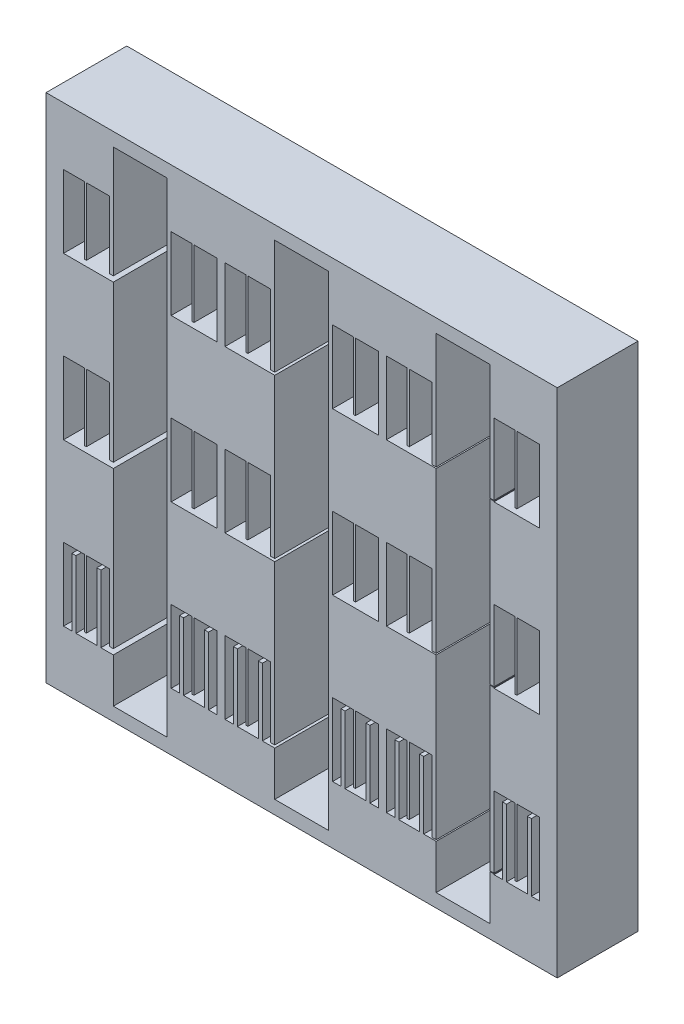
from build123d import *

# Parameters (mm, degrees)
SKETCH1_W           = 190
SKETCH1_H           = 190
BOSS_EXTRUDE1_DEPTH = 30
SKETCH2_W           = 20
SKETCH2_H           = 180
CUT_EXTRUDE1_DEPTH  = 138.658998979
SKETCH3_W           = 17
SKETCH3_H           = 27
CUT_EXTRUDE2_DEPTH  = 28.5
SKETCH4_W           = 1.5
SKETCH4_H           = 25
SKETCH4_W_2         = 0.75
BOSS_EXTRUDE2_DEPTH = 28.5
SKETCH5_W           = 1.5
SKETCH5_H           = 2
SKETCH5_H_2         = 1
SKETCH5_H_3         = 0.5
SKETCH5_H_4         = 0.25
CUT_EXTRUDE3_DEPTH  = 28.5


with BuildPart() as part:
    # Sketch1 → Boss-Extrude1 (new body)
    with BuildSketch(Plane.XY):
        Rectangle(SKETCH1_W, SKETCH1_H)
    extrude(amount=-BOSS_EXTRUDE1_DEPTH)

    # Sketch2 → Cut-Extrude1 (cut, through all)
    with BuildSketch(Plane.XY):
        with Locations((-60, 0)):
            Rectangle(SKETCH2_W, SKETCH2_H)
        Rectangle(SKETCH2_W, SKETCH2_H)
        with Locations((60, 0)):
            Rectangle(SKETCH2_W, SKETCH2_H)
    extrude(amount=-CUT_EXTRUDE1_DEPTH, mode=Mode.SUBTRACT)

    # Sketch3 → Cut-Extrude2 (cut)
    with BuildSketch(Plane.XY):
        with Locations((-80, -60)):
            Rectangle(SKETCH3_W, SKETCH3_H)
        with Locations((-40, -60)):
            Rectangle(SKETCH3_W, SKETCH3_H)
        with Locations((-20, -60)):
            Rectangle(SKETCH3_W, SKETCH3_H)
        with Locations((20, -60)):
            Rectangle(SKETCH3_W, SKETCH3_H)
        with Locations((40, -60)):
            Rectangle(SKETCH3_W, SKETCH3_H)
        with Locations((80, -60)):
            Rectangle(SKETCH3_W, SKETCH3_H)
        with Locations((-80, 0)):
            Rectangle(SKETCH3_W, SKETCH3_H)
        with Locations((-40, 0)):
            Rectangle(SKETCH3_W, SKETCH3_H)
        with Locations((-20, 0)):
            Rectangle(SKETCH3_W, SKETCH3_H)
        with Locations((20, 0)):
            Rectangle(SKETCH3_W, SKETCH3_H)
        with Locations((40, 0)):
            Rectangle(SKETCH3_W, SKETCH3_H)
        with Locations((80, 0)):
            Rectangle(SKETCH3_W, SKETCH3_H)
        with Locations((-80, 60)):
            Rectangle(SKETCH3_W, SKETCH3_H)
        with Locations((-40, 60)):
            Rectangle(SKETCH3_W, SKETCH3_H)
        with Locations((-20, 60)):
            Rectangle(SKETCH3_W, SKETCH3_H)
        with Locations((20, 60)):
            Rectangle(SKETCH3_W, SKETCH3_H)
        with Locations((40, 60)):
            Rectangle(SKETCH3_W, SKETCH3_H)
        with Locations((80, 60)):
            Rectangle(SKETCH3_W, SKETCH3_H)
    extrude(amount=-CUT_EXTRUDE2_DEPTH, mode=Mode.SUBTRACT)

    # Sketch4 → Boss-Extrude2 (add)
    with BuildSketch(Plane.XY):
        with Locations((-75.375, -61)):
            Rectangle(SKETCH4_W, SKETCH4_H)
        with Locations((-80.375, -59)):
            Rectangle(SKETCH4_W_2, SKETCH4_H)
        with Locations((-84.625, -61)):
            Rectangle(SKETCH4_W, SKETCH4_H)
        with Locations((-44.625, -61)):
            Rectangle(SKETCH4_W, SKETCH4_H)
        with Locations((-40.375, -59)):
            Rectangle(SKETCH4_W_2, SKETCH4_H)
        with Locations((-35.375, -61)):
            Rectangle(SKETCH4_W, SKETCH4_H)
        with Locations((-15.375, -61)):
            Rectangle(SKETCH4_W, SKETCH4_H)
        with Locations((-20.375, -59)):
            Rectangle(SKETCH4_W_2, SKETCH4_H)
        with Locations((-24.625, -61)):
            Rectangle(SKETCH4_W, SKETCH4_H)
        with Locations((15.375, -61)):
            Rectangle(SKETCH4_W, SKETCH4_H)
        with Locations((19.625, -59)):
            Rectangle(SKETCH4_W_2, SKETCH4_H)
        with Locations((24.625, -61)):
            Rectangle(SKETCH4_W, SKETCH4_H)
        with Locations((44.625, -61)):
            Rectangle(SKETCH4_W, SKETCH4_H)
        with Locations((39.625, -59)):
            Rectangle(SKETCH4_W_2, SKETCH4_H)
        with Locations((35.375, -61)):
            Rectangle(SKETCH4_W, SKETCH4_H)
        with Locations((75.375, -61)):
            Rectangle(SKETCH4_W, SKETCH4_H)
        with Locations((79.625, -59)):
            Rectangle(SKETCH4_W_2, SKETCH4_H)
        with Locations((84.625, -61)):
            Rectangle(SKETCH4_W, SKETCH4_H)
        with Locations((-80.375, 1)):
            Rectangle(SKETCH4_W_2, SKETCH4_H)
        with Locations((-40.375, 1)):
            Rectangle(SKETCH4_W_2, SKETCH4_H)
        with Locations((-20.375, 1)):
            Rectangle(SKETCH4_W_2, SKETCH4_H)
        with Locations((19.625, 1)):
            Rectangle(SKETCH4_W_2, SKETCH4_H)
        with Locations((39.625, 1)):
            Rectangle(SKETCH4_W_2, SKETCH4_H)
        with Locations((79.625, 1)):
            Rectangle(SKETCH4_W_2, SKETCH4_H)
        with Locations((-80.375, 61)):
            Rectangle(SKETCH4_W_2, SKETCH4_H)
        with Locations((-40.375, 61)):
            Rectangle(SKETCH4_W_2, SKETCH4_H)
        with Locations((-20.375, 61)):
            Rectangle(SKETCH4_W_2, SKETCH4_H)
        with Locations((19.625, 61)):
            Rectangle(SKETCH4_W_2, SKETCH4_H)
        with Locations((39.625, 61)):
            Rectangle(SKETCH4_W_2, SKETCH4_H)
        with Locations((79.625, 61)):
            Rectangle(SKETCH4_W_2, SKETCH4_H)
    extrude(amount=-BOSS_EXTRUDE2_DEPTH)

    # Sketch5 → Cut-Extrude3 (cut)
    with BuildSketch(Plane.XY):
        with Locations((-70.75, -72.5)):
            Rectangle(SKETCH5_W, SKETCH5_H)
        with Locations((-10.75, -73)):
            Rectangle(SKETCH5_W, SKETCH5_H_2)
        with Locations((49.25, -73.25)):
            Rectangle(SKETCH5_W, SKETCH5_H_3)
        with Locations((70.75, -73.125)):
            Rectangle(SKETCH5_W, SKETCH5_H_4)
        with Locations((-70.75, -12.5)):
            Rectangle(SKETCH5_W, SKETCH5_H)
        with Locations((-10.75, -13)):
            Rectangle(SKETCH5_W, SKETCH5_H_2)
        with Locations((49.25, -13.25)):
            Rectangle(SKETCH5_W, SKETCH5_H_3)
        with Locations((70.75, -13.125)):
            Rectangle(SKETCH5_W, SKETCH5_H_4)
        with Locations((-70.75, 47.5)):
            Rectangle(SKETCH5_W, SKETCH5_H)
        with Locations((-10.75, 47)):
            Rectangle(SKETCH5_W, SKETCH5_H_2)
        with Locations((49.25, 46.75)):
            Rectangle(SKETCH5_W, SKETCH5_H_3)
        with Locations((70.75, 46.875)):
            Rectangle(SKETCH5_W, SKETCH5_H_4)
    extrude(amount=-CUT_EXTRUDE3_DEPTH, mode=Mode.SUBTRACT)


solid = part.part
